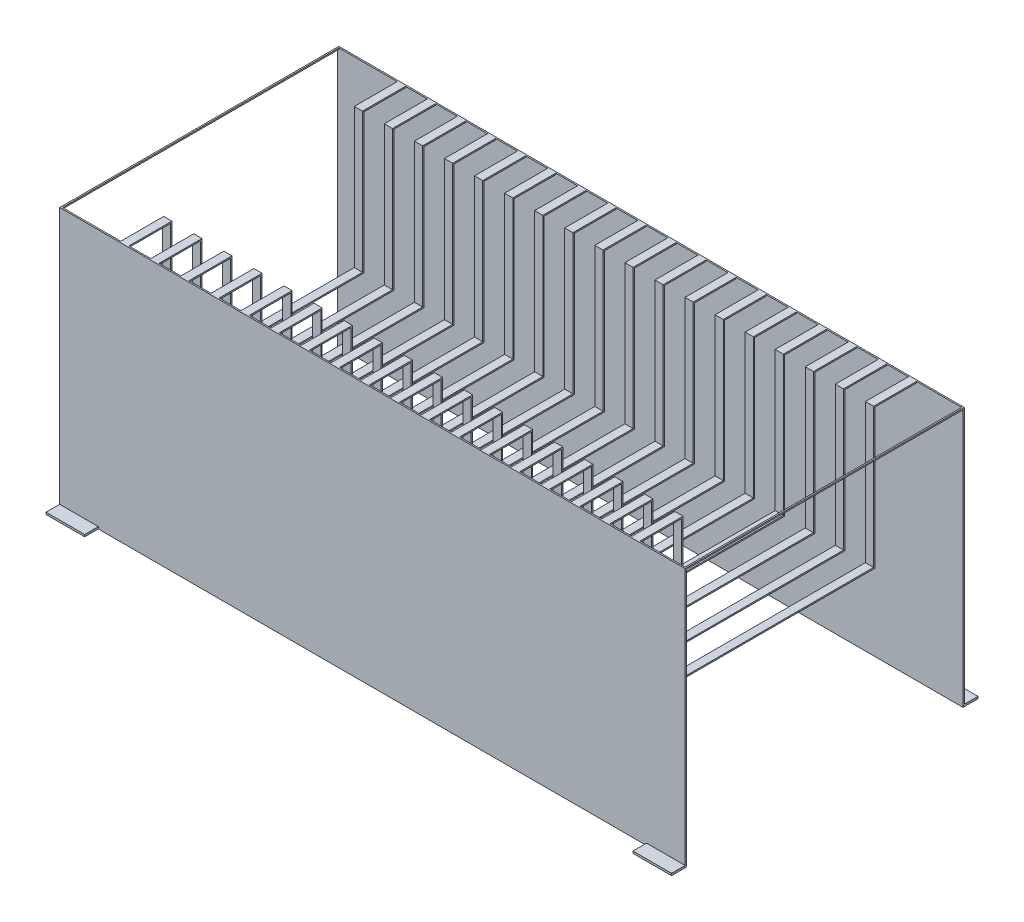
from build123d import *

# Parameters (mm, degrees)
SALIENTE_EXTRUIR1_DEPTH = 1300
CROQUIS2_W              = 2912.7
CROQUIS2_H              = 1206.35
SALIENTE_EXTRUIR2_DEPTH = 6.35
CROQUIS3_W              = 2912.7
CROQUIS3_H              = 1206.35
SALIENTE_EXTRUIR3_DEPTH = 6.35
CROQUIS4_W              = 38.1
CROQUIS4_H              = 200
SALIENTE_EXTRUIR4_DEPTH = 6.35
MATRIZL1_COUNT          = 18
MATRIZL1_PITCH          = 140
CROQUIS5_W              = 1287.3
CROQUIS5_H              = 1206.789691525
CORTAR_EXTRUIR1_DEPTH   = 2912.7
CROQUIS6_W              = 38.1
CROQUIS6_H              = 6.35
SALIENTE_EXTRUIR5_DEPTH = 650
MATRIZL2_COUNT          = 18
MATRIZL2_PITCH          = 140
CROQUIS7_W              = 38.1
CROQUIS7_H              = 6.35
SALIENTE_EXTRUIR6_DEPTH = 650
MATRIZL3_COUNT          = 18
MATRIZL3_PITCH          = 140
CROQUIS8_W              = 38.1
CROQUIS8_H              = 6.35
SALIENTE_EXTRUIR7_DEPTH = 887.3
MATRIZL4_COUNT          = 18
MATRIZL4_PITCH          = 140
CROQUIS9_W              = 180
CROQUIS9_H              = 63.5
SALIENTE_EXTRUIR8_DEPTH = 9.525


with BuildPart() as part:
    # Croquis1 → Saliente-Extruir1 (new body)
    with BuildSketch(Plane.XY):
        Polygon((0, 0), (0, 1200), (-6.35, 1200), (-6.35, -6.35), (2906.35, -6.35), (2906.35, 1200), (2900, 1200), (2900, 0), align=None)
    extrude(amount=SALIENTE_EXTRUIR1_DEPTH)

    # Croquis2 → Saliente-Extruir2 (add)
    with BuildSketch(Plane.XY.offset(1300)):
        with Locations((1450, 596.825)):
            Rectangle(CROQUIS2_W, CROQUIS2_H)
    extrude(amount=-SALIENTE_EXTRUIR2_DEPTH)

    # Croquis3 → Saliente-Extruir3 (add)
    with BuildSketch(Plane(origin=(0, 0, 0), x_dir=(-1, 0, 0), z_dir=(0, 0, -1))):
        with Locations((-1450, 596.825)):
            Rectangle(CROQUIS3_W, CROQUIS3_H)
    extrude(amount=-SALIENTE_EXTRUIR3_DEPTH)

    # Croquis4 → Saliente-Extruir4 (add)
    with BuildSketch(Plane(origin=(0, 1200, 0), x_dir=(1, 0, 0), z_dir=(0, 1, 0))):
        with Locations((2670.95, -1193.65)):
            Rectangle(CROQUIS4_W, CROQUIS4_H)
        with Locations((2670.95, -106.35)):
            Rectangle(CROQUIS4_W, CROQUIS4_H)
    saliente_extruir4 = extrude(amount=-SALIENTE_EXTRUIR4_DEPTH)

    # MatrizL1: Saliente-Extruir4 ×18
    with Locations(*[(-i * MATRIZL1_PITCH, 0, 0) for i in range(1, MATRIZL1_COUNT)]):
        add(saliente_extruir4)

    # Croquis5 → Cortar-Extruir1 (cut)
    with BuildSketch(Plane.ZY.offset(6.35)):
        with Locations((650, 590.255154238)):
            Rectangle(CROQUIS5_W, CROQUIS5_H)
    extrude(amount=-CORTAR_EXTRUIR1_DEPTH, mode=Mode.SUBTRACT)

    # Croquis6 → Saliente-Extruir5 (add)
    with BuildSketch(Plane.XZ.offset(-1193.65)):
        with Locations((290.95, 203.175)):
            Rectangle(CROQUIS6_W, CROQUIS6_H)
    saliente_extruir5 = extrude(amount=SALIENTE_EXTRUIR5_DEPTH)

    # MatrizL2: Saliente-Extruir5 ×18
    with Locations(*[(i * MATRIZL2_PITCH, 0, 0) for i in range(1, MATRIZL2_COUNT)]):
        add(saliente_extruir5)

    # Croquis7 → Saliente-Extruir6 (add)
    with BuildSketch(Plane.XZ.offset(-1193.65)):
        with Locations((2670.95, 1096.825)):
            Rectangle(CROQUIS7_W, CROQUIS7_H)
    saliente_extruir6 = extrude(amount=SALIENTE_EXTRUIR6_DEPTH)

    # MatrizL3: Saliente-Extruir6 ×18
    with Locations(*[(-i * MATRIZL3_PITCH, 0, 0) for i in range(1, MATRIZL3_COUNT)]):
        add(saliente_extruir6)

    # Croquis8 → Saliente-Extruir7 (add)
    with BuildSketch(Plane(origin=(0, 0, 1093.65), x_dir=(-1, 0, 0), z_dir=(0, 0, -1))):
        with Locations((-2670.95, 546.825)):
            Rectangle(CROQUIS8_W, CROQUIS8_H)
    saliente_extruir7 = extrude(amount=SALIENTE_EXTRUIR7_DEPTH)

    # MatrizL4: Saliente-Extruir7 ×18
    with Locations(*[(-i * MATRIZL4_PITCH, 0, 0) for i in range(1, MATRIZL4_COUNT)]):
        add(saliente_extruir7)

    # Croquis9 → Saliente-Extruir8 (add)
    with BuildSketch(Plane.XZ.offset(6.35)):
        with Locations((2816.35, 1331.75)):
            Rectangle(CROQUIS9_W, CROQUIS9_H)
        with Locations((2816.35, -31.75)):
            Rectangle(CROQUIS9_W, CROQUIS9_H)
        with Locations((83.65, -31.75)):
            Rectangle(CROQUIS9_W, CROQUIS9_H)
        with Locations((83.65, 1331.75)):
            Rectangle(CROQUIS9_W, CROQUIS9_H)
    extrude(amount=-SALIENTE_EXTRUIR8_DEPTH)


solid = part.part
